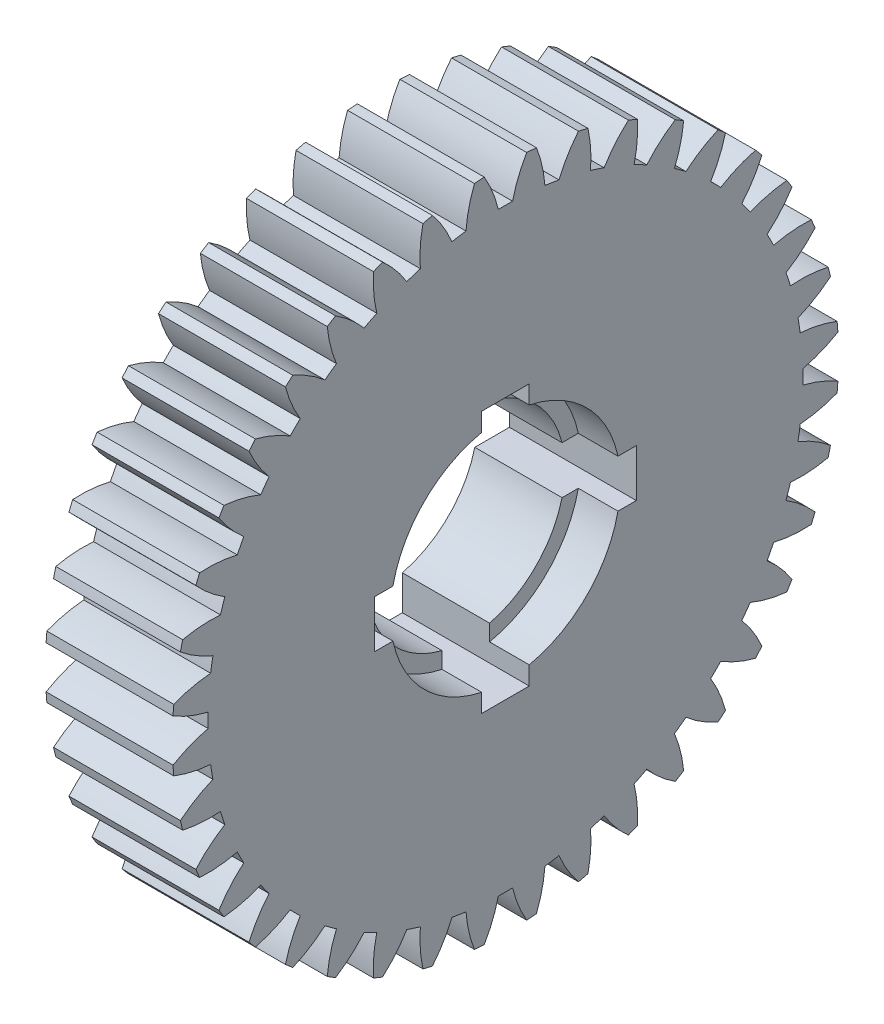
from build123d import *

# Parameters (mm, degrees)
BASPROSKE_W        = 8
BASPROSKE_H        = 21
TOOTHCUT_DEPTH     = 31.757112998
TEETHCUTS_COUNT    = 40
BORSKE_R           = 2.5
BORE_DEPTH         = 50.0000508
SKETCH1_R          = 30.395157115
CUT_EXTRUDE1_DEPTH = 0.0001
CUT_EXTRUDE2_DEPTH = 31.698631026
SKETCH3_R          = 7.25
CUT_EXTRUDE3_DEPTH = 2.5


with BuildPart() as part:
    # BasProSke → Base-Revolve (revolve)
    with BuildSketch(Plane(origin=(0, 0, 0), x_dir=(1, 0, 0), z_dir=(0, 1, 0)), mode=Mode.PRIVATE) as base_revolve_sk:
        with Locations((4, 10.5)):
            Rectangle(BASPROSKE_W, BASPROSKE_H)
    revolve(base_revolve_sk.sketch.rotate(Axis((-10, 0, 0), (1, 0, 0)), 180), axis=Axis((-10, 0, 0), (1, 0, 0)))

    # TooCutSke → ToothCut (cut, through all)
    with BuildSketch(Plane(origin=(0, 0, 0), x_dir=(0, 0, -1), z_dir=(1, 0, 0))):
        with BuildLine():
            ThreePointArc((0.448673268, 18.74363074), (0, 18.749), (-0.448673268, 18.74363074))
            ThreePointArc((-0.448673268, 18.74363074), (-0.816786816, 19.89705013), (-1.354745081, 20.981708961))
            ThreePointArc((-1.354745081, 20.981708961), (0, 21.0254), (1.354745081, 20.981708961))
            ThreePointArc((1.354745081, 20.981708961), (0.816786816, 19.89705013), (0.448673268, 18.74363074))
        make_face()
    toothcut = extrude(amount=TOOTHCUT_DEPTH, mode=Mode.SUBTRACT)

    # TeethCuts: ToothCut ×40 about axis
    teethcuts_axis = Axis((0, 0, 0), (1, 0, 0))
    for i in range(1, TEETHCUTS_COUNT):
        add(toothcut.rotate(teethcuts_axis, i * 360 / TEETHCUTS_COUNT), mode=Mode.SUBTRACT)

    # BorSke → Bore (cut, symmetric)
    with BuildSketch(Plane(origin=(0, 0, 0), x_dir=(0, 0, -1), z_dir=(1, 0, 0))):
        with Locations(Location((0, 0, 0), (0, 0, 180))):
            Circle(BORSKE_R)
    extrude(amount=BORE_DEPTH, both=True, mode=Mode.SUBTRACT)

    # Sketch1 → Cut-Extrude1 (cut)
    with BuildSketch(Plane(origin=(8, 0, 0), x_dir=(0, 0, -1), z_dir=(1, 0, 0))):
        with Locations((-0.364084054, 0)):
            Circle(SKETCH1_R)
    extrude(amount=-CUT_EXTRUDE1_DEPTH, mode=Mode.SUBTRACT)

    # Sketch2 → Cut-Extrude2 (cut, through all)
    with BuildSketch(Plane(origin=(7.9999, 0, 0), x_dir=(0, 0, -1), z_dir=(1, 0, 0))):
        with BuildLine():
            Line((-1.5, 8.25), (1.5, 8.25))
            Line((1.5, 8.25), (1.5, 6.06733055))
            ThreePointArc((1.5, 6.06733055), (4.419417382, 4.419417382), (6.06733055, 1.5))
            Line((6.06733055, 1.5), (8.25, 1.5))
            Line((8.25, 1.5), (8.25, -1.5))
            Line((8.25, -1.5), (6.06733055, -1.5))
            ThreePointArc((6.06733055, -1.5), (4.419417382, -4.419417382), (1.5, -6.06733055))
            Line((1.5, -6.06733055), (1.5, -8.25))
            Line((1.5, -8.25), (-1.5, -8.25))
            Line((-1.5, -8.25), (-1.5, -6.06733055))
            ThreePointArc((-1.5, -6.06733055), (-4.419417382, -4.419417382), (-6.06733055, -1.5))
            Line((-6.06733055, -1.5), (-8.25, -1.5))
            Line((-8.25, -1.5), (-8.25, 1.5))
            Line((-8.25, 1.5), (-6.06733055, 1.5))
            ThreePointArc((-6.06733055, 1.5), (-4.419417382, 4.419417382), (-1.5, 6.06733055))
            Line((-1.5, 6.06733055), (-1.5, 8.25))
        make_face()
    extrude(amount=-CUT_EXTRUDE2_DEPTH, mode=Mode.SUBTRACT)

    # Sketch3 → Cut-Extrude3 (cut)
    with BuildSketch(Plane(origin=(7.9999, 0, 0), x_dir=(0, 0, -1), z_dir=(1, 0, 0))):
        Circle(SKETCH3_R)
    extrude(amount=-CUT_EXTRUDE3_DEPTH, mode=Mode.SUBTRACT)


solid = part.part
